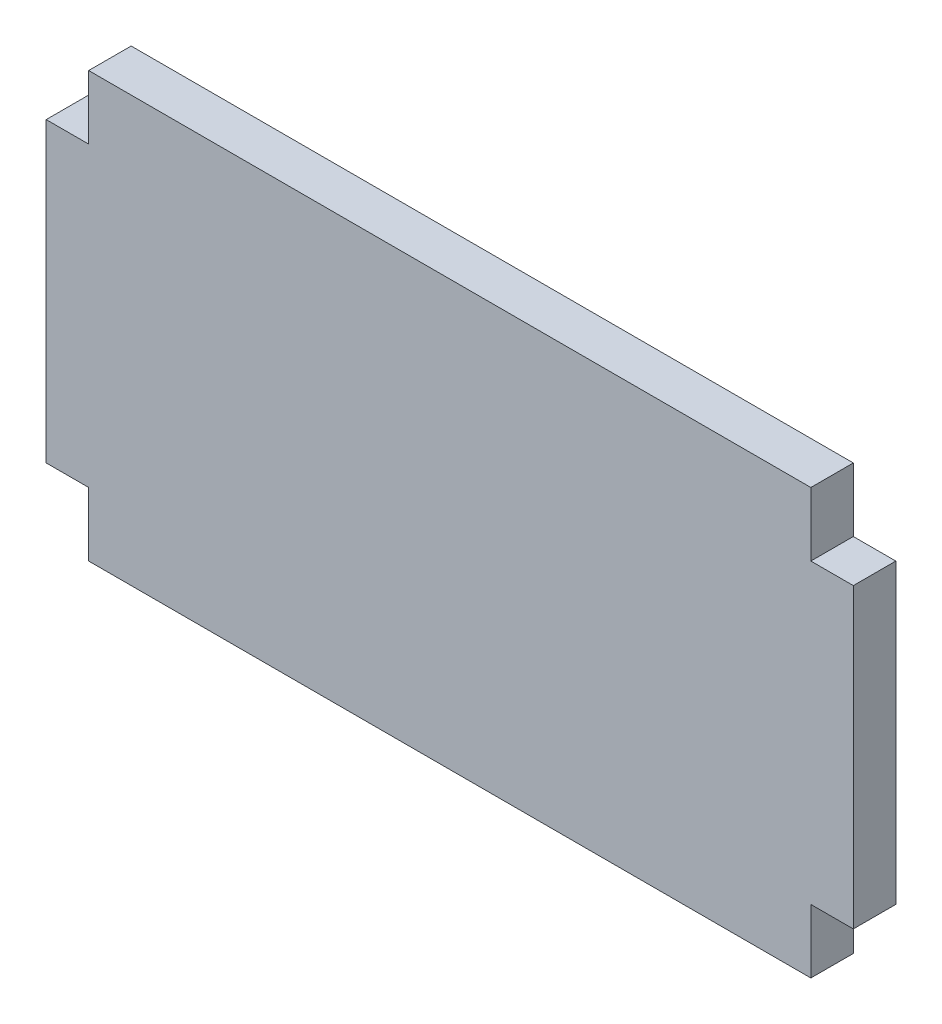
from build123d import *

# Parameters (mm, degrees)
SALIENTE_EXTRUIR1_DEPTH = 5


with BuildPart() as part:
    # Croquis1 → Saliente-Extruir1 (new body)
    with BuildSketch(Plane.XY):
        Polygon((-42.5, -25), (42.5, -25), (42.5, -17.5), (47.5, -17.5), (47.5, 17.5), (42.5, 17.5), (42.5, 25), (-42.5, 25), (-42.5, 17.5), (-47.5, 17.5), (-47.5, -17.5), (-42.5, -17.5), align=None)
    extrude(amount=SALIENTE_EXTRUIR1_DEPTH)


solid = part.part
